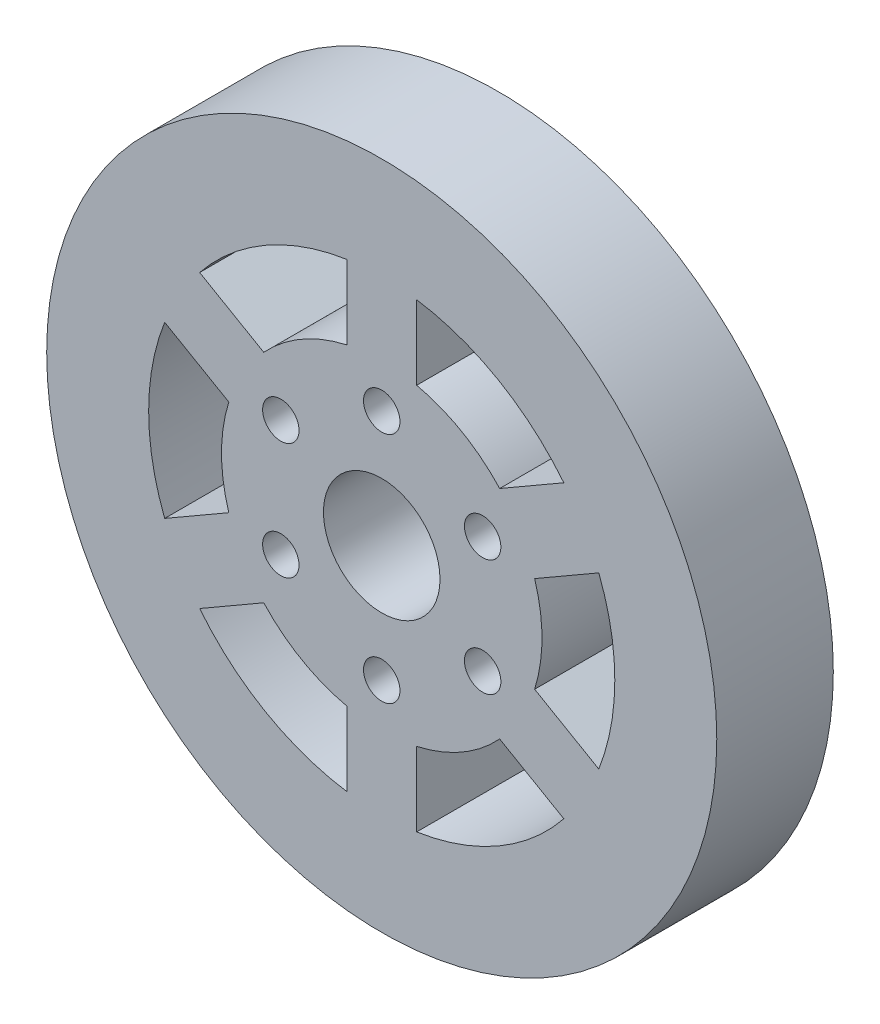
from build123d import *

# Parameters (mm, degrees)
SKETCH3_R               = 73.025
BOSS_EXTRUDE2_DEPTH     = 25.4
CUT_EXTRUDE1_DEPTH      = 107.350652325
CUT_EXTRUDE1_DEPTH_BACK = 107.350652325
SKETCH4_R               = 3.96875
SKETCH4_R_2             = 12.7


with BuildPart() as part:
    # Sketch3 → Boss-Extrude2 (new body)
    with BuildSketch(Plane.XY):
        Circle(SKETCH3_R)
    extrude(amount=-BOSS_EXTRUDE2_DEPTH)

    # Sketch4 → Cut-Extrude1 (cut, two sides: drawn at the far end of the back side and taken through both)
    with BuildSketch(Plane.XY.offset(-CUT_EXTRUDE1_DEPTH_BACK)):
        with BuildLine():
            ThreePointArc((-39.686341225, -31.711737892), (-25.4, -43.994090512), (-7.62, -50.225248631))
            Line((-7.62, -50.225248631), (-7.62, -34.083591727))
            ThreePointArc((-7.62, -34.083591727), (-17.4625, -30.245937227), (-25.707256288, -23.64090944))
            Line((-25.707256288, -23.64090944), (-39.686341225, -31.711737892))
        make_face()
        with BuildLine():
            Line((7.62, -34.083591727), (7.62, -50.225248631))
            ThreePointArc((7.62, -50.225248631), (25.4, -43.994090512), (39.686341225, -31.711737892))
            Line((39.686341225, -31.711737892), (25.707256288, -23.64090944))
            ThreePointArc((25.707256288, -23.64090944), (17.4625, -30.245937227), (7.62, -34.083591727))
        make_face()
        with Locations((0, -25.4)):
            Circle(SKETCH4_R)
        with BuildLine():
            ThreePointArc((-47.306341225, 18.513510738), (-50.8, 0), (-47.306341225, -18.513510738))
            Line((-47.306341225, -18.513510738), (-33.327256288, -10.442682287))
            ThreePointArc((-33.327256288, -10.442682287), (-34.925, 0), (-33.327256288, 10.442682287))
            Line((-33.327256288, 10.442682287), (-47.306341225, 18.513510738))
        make_face()
        with BuildLine():
            Line((33.327256288, -10.442682287), (47.306341225, -18.513510738))
            ThreePointArc((47.306341225, -18.513510738), (50.8, 0), (47.306341225, 18.513510738))
            Line((47.306341225, 18.513510738), (33.327256288, 10.442682287))
            ThreePointArc((33.327256288, 10.442682287), (34.925, 0), (33.327256288, -10.442682287))
        make_face()
        Circle(SKETCH4_R_2)
        with Locations((-21.997045256, -12.7)):
            Circle(SKETCH4_R)
        with Locations((21.997045256, -12.7)):
            Circle(SKETCH4_R)
        with BuildLine():
            ThreePointArc((-7.62, 50.225248631), (-25.4, 43.994090512), (-39.686341225, 31.711737892))
            Line((-39.686341225, 31.711737892), (-25.707256288, 23.64090944))
            ThreePointArc((-25.707256288, 23.64090944), (-17.4625, 30.245937227), (-7.62, 34.083591727))
            Line((-7.62, 34.083591727), (-7.62, 50.225248631))
        make_face()
        with Locations((-21.997045256, 12.7)):
            Circle(SKETCH4_R)
        with Locations((21.997045256, 12.7)):
            Circle(SKETCH4_R)
        with BuildLine():
            Line((25.707256288, 23.64090944), (39.686341225, 31.711737892))
            ThreePointArc((39.686341225, 31.711737892), (25.4, 43.994090512), (7.62, 50.225248631))
            Line((7.62, 50.225248631), (7.62, 34.083591727))
            ThreePointArc((7.62, 34.083591727), (17.4625, 30.245937227), (25.707256288, 23.64090944))
        make_face()
        with Locations((0, 25.4)):
            Circle(SKETCH4_R)
    extrude(amount=CUT_EXTRUDE1_DEPTH + CUT_EXTRUDE1_DEPTH_BACK, mode=Mode.SUBTRACT)


solid = part.part
